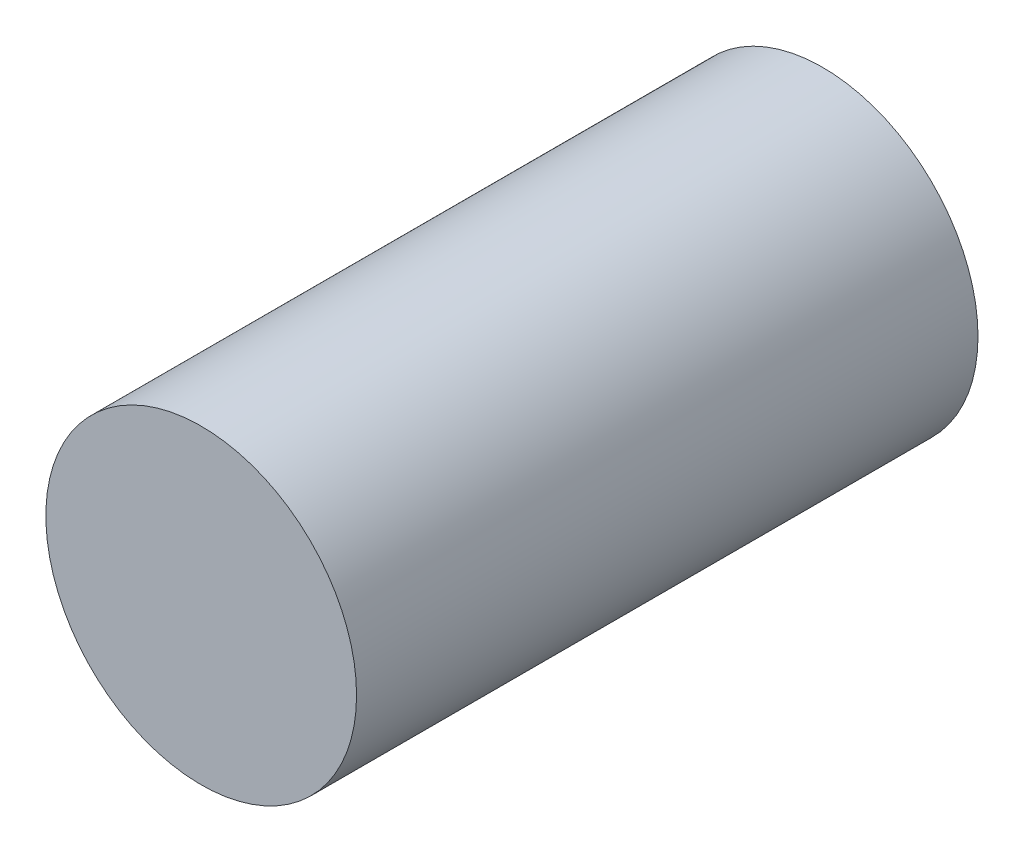
from build123d import *

# Parameters (mm, degrees)
TOPPING_SOG_KOMPRESOR_YATIK_D100_START = -400
SKETCH1_R                              = 50
TOPPING_SOG_KOMPRESOR_YATIK_D100_DEPTH = 200


with BuildPart() as part:
    # Sketch1 → TOPPING_sog_kompresor_yatik_D100 (new body)
    with BuildSketch(Plane.XY.offset(TOPPING_SOG_KOMPRESOR_YATIK_D100_START)):
        with Locations((200, 105)):
            Circle(SKETCH1_R)
    extrude(amount=-TOPPING_SOG_KOMPRESOR_YATIK_D100_DEPTH)


solid = part.part
